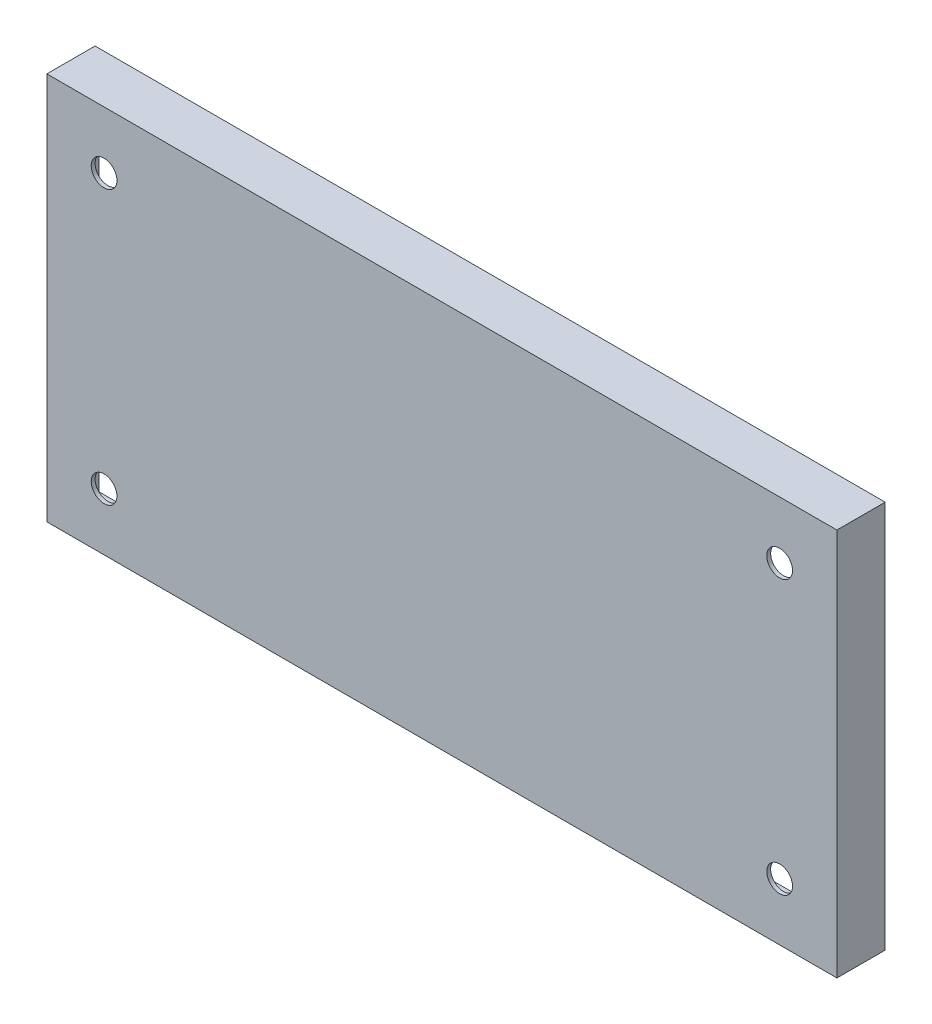
from build123d import *

# Parameters (mm, degrees)
SKETCH_1_W          = 245.6
SKETCH_1_H          = 120.6
EXTRUDE_1_DEPTH     = 15
SHELL_1_T           = -1.2
SKETCH_2_R          = 4
CUT_EXTRUDE_1_DEPTH = 15


with BuildPart() as part:
    # 草图1 → 凸台-拉伸1 (new body)
    with BuildSketch(Plane.XY):
        Rectangle(SKETCH_1_W, SKETCH_1_H)
    extrude(amount=EXTRUDE_1_DEPTH)

    # 抽壳1
    shell_1_openings = [part.faces().sort_by_distance(p)[0] for p in [
        (0, 0, 0),
    ]]
    offset(amount=SHELL_1_T, openings=shell_1_openings, kind=Kind.INTERSECTION)

    # 草图2 → 切除-拉伸1 (cut)
    with BuildSketch(Plane.XY.offset(15)):
        with Locations((-105, 42.5)):
            Circle(SKETCH_2_R)
        with Locations((105, 42.5)):
            Circle(SKETCH_2_R)
        with Locations((105, -42.5)):
            Circle(SKETCH_2_R)
        with Locations((-105, -42.5)):
            Circle(SKETCH_2_R)
    extrude(amount=-CUT_EXTRUDE_1_DEPTH, mode=Mode.SUBTRACT)


solid = part.part
